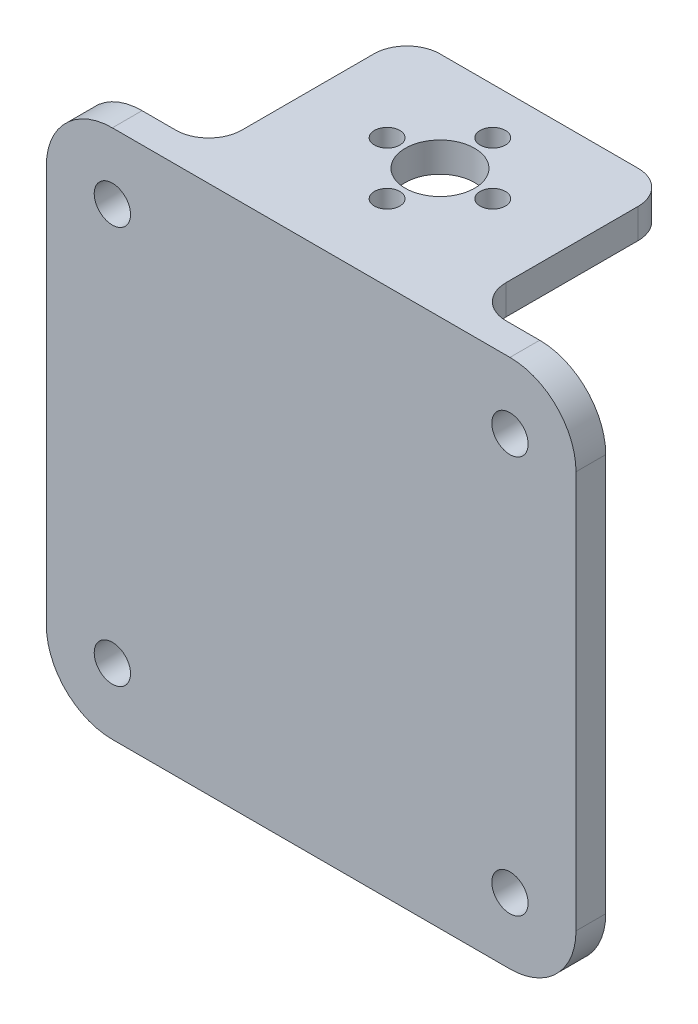
from build123d import *

# Parameters (mm, degrees)
SKETCH1_W            = 80.2
SKETCH1_H            = 80.2
BOSS_EXTRUDE1_DEPTH  = 4.5
M5_CLEARANCE_HOLE1_D = 5.5
SKETCH3_W            = 40
SKETCH3_H            = 4.5
BOSS_EXTRUDE2_DEPTH  = 30
CUT_EXTRUDE1_REACH   = 92.766
SKETCH4_R            = 5.25
CUT_EXTRUDE2_REACH   = 92.766
SKETCH5_R            = 1.924517265
FILLET2_R            = 10
FILLET4_R            = 5
FILLET3_R            = 5
CUT_EXTRUDE3_REACH   = 92.766
SKETCH6_R            = 11.25
FILLET5_R            = 5


with BuildPart() as part:
    # Sketch1 → Boss-Extrude1 (new body)
    with BuildSketch(Plane.XY):
        Rectangle(SKETCH1_W, SKETCH1_H)
    extrude(amount=BOSS_EXTRUDE1_DEPTH)

    # M5 Clearance Hole1 (through all)
    with Locations(Plane(origin=(-30.1, -30.1, 0), x_dir=(-1, 0, 0), z_dir=(0, 0, -1))):
        with Locations((0, 0), (-60.2, 60.2), (0, 60.2), (-60.2, 0)):
            Hole(M5_CLEARANCE_HOLE1_D / 2)

    # Sketch3 → Boss-Extrude2 (add)
    with BuildSketch(Plane(origin=(0, 0, 0), x_dir=(-1, 0, 0), z_dir=(0, 0, -1))):
        with Locations((0, 37.85)):
            Rectangle(SKETCH3_W, SKETCH3_H)
    extrude(amount=BOSS_EXTRUDE2_DEPTH)

    # Sketch4 → Cut-Extrude1 (cut, up to next)
    with BuildSketch(Plane(origin=(0, 35.6, 0), x_dir=(-1, 0, 0), z_dir=(0, -1, 0)), mode=Mode.PRIVATE) as cut_extrude1_sk1:
        with Locations(Location((0, 15, 0), (0, 0, 90))):
            Circle(SKETCH4_R)
    cut_extrude1_tool1 = extrude(cut_extrude1_sk1.sketch, amount=-CUT_EXTRUDE1_REACH, mode=Mode.PRIVATE) & part.part
    add(cut_extrude1_tool1.solids().sort_by_distance((0, 35.6, -15))[0], mode=Mode.SUBTRACT)

    # Sketch5 → Cut-Extrude2 (cut, up to next)
    with BuildSketch(Plane.XZ.offset(-35.6), mode=Mode.PRIVATE) as cut_extrude2_sk1:
        with Locations(Location((0, -23, 0), (0, 0, 270))):
            Circle(SKETCH5_R)
    cut_extrude2_tool1 = extrude(cut_extrude2_sk1.sketch, amount=-CUT_EXTRUDE2_REACH, mode=Mode.PRIVATE) & part.part
    # Sketch5 → Cut-Extrude2 (cut, up to next)
    with BuildSketch(Plane.XZ.offset(-35.6), mode=Mode.PRIVATE) as cut_extrude2_sk2:
        with Locations(Location((-8, -15, 0), (0, 0, 270))):
            Circle(SKETCH5_R)
    cut_extrude2_tool2 = extrude(cut_extrude2_sk2.sketch, amount=-CUT_EXTRUDE2_REACH, mode=Mode.PRIVATE) & part.part
    # Sketch5 → Cut-Extrude2 (cut, up to next)
    with BuildSketch(Plane.XZ.offset(-35.6), mode=Mode.PRIVATE) as cut_extrude2_sk3:
        with Locations(Location((0, -7, 0), (0, 0, 270))):
            Circle(SKETCH5_R)
    cut_extrude2_tool3 = extrude(cut_extrude2_sk3.sketch, amount=-CUT_EXTRUDE2_REACH, mode=Mode.PRIVATE) & part.part
    # Sketch5 → Cut-Extrude2 (cut, up to next)
    with BuildSketch(Plane.XZ.offset(-35.6), mode=Mode.PRIVATE) as cut_extrude2_sk4:
        with Locations(Location((8, -15, 0), (0, 0, 270))):
            Circle(SKETCH5_R)
    cut_extrude2_tool4 = extrude(cut_extrude2_sk4.sketch, amount=-CUT_EXTRUDE2_REACH, mode=Mode.PRIVATE) & part.part
    add(cut_extrude2_tool1.solids().sort_by_distance((0, 35.6, -23))[0], mode=Mode.SUBTRACT)
    add(cut_extrude2_tool2.solids().sort_by_distance((-8, 35.6, -15))[0], mode=Mode.SUBTRACT)
    add(cut_extrude2_tool3.solids().sort_by_distance((0, 35.6, -7))[0], mode=Mode.SUBTRACT)
    add(cut_extrude2_tool4.solids().sort_by_distance((8, 35.6, -15))[0], mode=Mode.SUBTRACT)

    # Fillet2
    fillet2_edges = [part.edges().sort_by_distance(p)[0] for p in [
        (40.1, -40.1, 2.25),
        (-40.1, -40.1, 2.25),
        (-40.1, 40.1, 2.25),
        (40.1, 40.1, 2.25),
    ]]
    fillet(fillet2_edges, radius=FILLET2_R)

    # Fillet4
    fillet4_edges = [part.edges().sort_by_distance(p)[0] for p in [
        (0, 35.6, 0),
    ]]
    fillet(fillet4_edges, radius=FILLET4_R)

    # Fillet3
    fillet3_edges = [part.edges().sort_by_distance(p)[0] for p in [
        (-20, 37.85, -30),
        (20, 37.85, -30),
    ]]
    fillet(fillet3_edges, radius=FILLET3_R)

    # Sketch6 → Cut-Extrude3 (cut, up to next)
    with BuildSketch(Plane.XZ.offset(-35.6), mode=Mode.PRIVATE) as cut_extrude3_sk1:
        with Locations((0, -15)):
            Circle(SKETCH6_R)
    cut_extrude3_tool1 = extrude(cut_extrude3_sk1.sketch, amount=CUT_EXTRUDE3_REACH, mode=Mode.PRIVATE) & part.part
    add(cut_extrude3_tool1.solids().sort_by_distance((0, 35.6, -15))[0], mode=Mode.SUBTRACT)

    # Fillet5
    fillet5_edges = [part.edges().sort_by_distance(p)[0] for p in [
        (-20, 35.35, 0),
        (20, 35.35, 0),
    ]]
    fillet(fillet5_edges, radius=FILLET5_R)


solid = part.part
